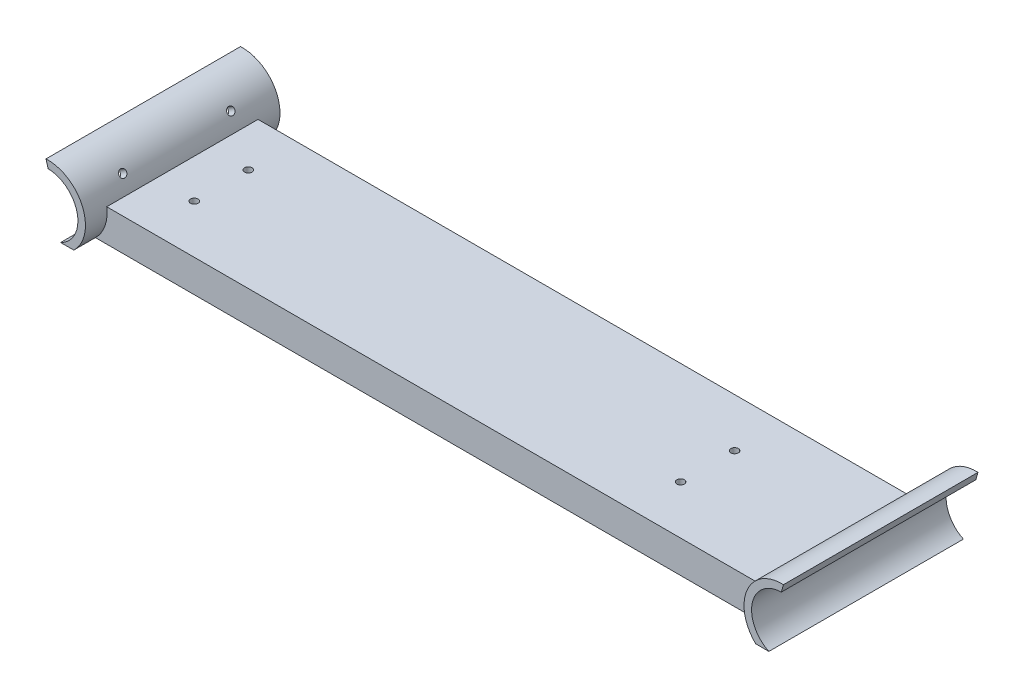
from build123d import *

# Parameters (mm, degrees)
BOSS_EXTRUDE3_DEPTH       = 70
BOSS_EXTRUDE4_DEPTH       = 90
M8_TAPPED_HOLE2_D         = 6.8
MIRROR5_COPY_1_D          = 6.8
M8X1_0_TAPPED_HOLE1_D     = 7
M8X1_0_TAPPED_HOLE1_DEPTH = 11
M8X1_0_TAPPED_HOLE1_TIP   = 2.103012167
M8X1_0_TAPPED_HOLE2_D     = 7
M8X1_0_TAPPED_HOLE2_DEPTH = 11
M8X1_0_TAPPED_HOLE2_TIP   = 2.103012167


with BuildPart() as part:
    # Sketch2 → Boss-Extrude3 (new, symmetric)
    with BuildSketch(Plane.XY):
        with BuildLine():
            ThreePointArc((-61, 30), (-62.647726429, 13.739490403), (-71.499030185, 0))
            Line((-71.499030185, 0), (244, 0))
            Line((244, 0), (244, 30))
            Line((244, 30), (-61, 30))
        make_face()
        with BuildLine():
            Line((244, 30), (244, 0))
            Line((244, 0), (559.499030185, 0))
            ThreePointArc((559.499030185, 0), (550.647726429, 13.739490403), (549, 30))
            Line((549, 30), (244, 30))
        make_face()
    extrude(amount=BOSS_EXTRUDE3_DEPTH, both=True)

    # Sketch2<3> → Boss-Extrude4 (add, symmetric)
    with BuildSketch(Plane.XY):
        with BuildLine():
            Line((585.195897576, 60.268095002), (583.196848208, 53.296581361))
            ThreePointArc((583.196848208, 53.296581361), (556.31388494, 31.210623184), (571.688547964, 0))
            Line((571.688547964, 0), (559.499030185, 0))
            ThreePointArc((559.499030185, 0), (551.487488703, 39.028239626), (585.195897576, 60.268095002))
        make_face()
        with BuildLine():
            Line((-83.688547964, 0), (-71.499030185, 0))
            ThreePointArc((-71.499030185, 0), (-63.487488703, 39.028239626), (-97.195897576, 60.268095002))
            Line((-97.195897576, 60.268095002), (-95.196848208, 53.296581361))
            ThreePointArc((-95.196848208, 53.296581361), (-68.31388494, 31.210623184), (-83.688547964, 0))
        make_face()
    extrude(amount=BOSS_EXTRUDE4_DEPTH, both=True)

    # M8 Tapped Hole2 (through all)
    with Locations(Plane(origin=(560.080057986, 40.36388188, 50), x_dir=(0.537967071811, 0.842965853191, 0), z_dir=(0.842965853191, -0.537967071811, 0))):
        with Locations((1e-09, 0)):
            m8_tapped_hole2 = Hole(M8_TAPPED_HOLE2_D / 2)

    # Mirror4: M8 Tapped Hole2 across plane
    add(m8_tapped_hole2.mirror(Plane.XY), mode=Mode.SUBTRACT)

    # Mirror5: M8 Tapped Hole2 across plane
    add(m8_tapped_hole2.mirror(Plane.ZY.offset(-244)), mode=Mode.SUBTRACT)

    # Mirror5 copy 1 (through all)
    with Locations(Plane(origin=(-72.080057986, 40.36388188, -50), x_dir=(-0.5379670718110001, 0.8429658531909999, 0), z_dir=(-0.8429658531909999, -0.5379670718110001, 0))):
        with Locations((1e-09, 0)):
            Hole(MIRROR5_COPY_1_D / 2)

    # M8x1.0 Tapped Hole1
    with Locations(Plane(origin=(0, 30, 0), x_dir=(1, 0, 0), z_dir=(0, 1, 0))):
        with Locations((425, 25), (425, -25)):
            Hole(M8X1_0_TAPPED_HOLE1_D / 2, depth=M8X1_0_TAPPED_HOLE1_DEPTH)
            with Locations((0, 0, -(M8X1_0_TAPPED_HOLE1_DEPTH + M8X1_0_TAPPED_HOLE1_TIP / 2))):  # 118° drill point
                Cone(0, M8X1_0_TAPPED_HOLE1_D / 2, M8X1_0_TAPPED_HOLE1_TIP, mode=Mode.SUBTRACT)

    # M8x1.0 Tapped Hole2
    with Locations(Plane(origin=(0, 30, 0), x_dir=(1, 0, 0), z_dir=(0, 1, 0))):
        with Locations((-25, 25), (-25, -25)):
            Hole(M8X1_0_TAPPED_HOLE2_D / 2, depth=M8X1_0_TAPPED_HOLE2_DEPTH)
            with Locations((0, 0, -(M8X1_0_TAPPED_HOLE2_DEPTH + M8X1_0_TAPPED_HOLE2_TIP / 2))):  # 118° drill point
                Cone(0, M8X1_0_TAPPED_HOLE2_D / 2, M8X1_0_TAPPED_HOLE2_TIP, mode=Mode.SUBTRACT)


solid = part.part
